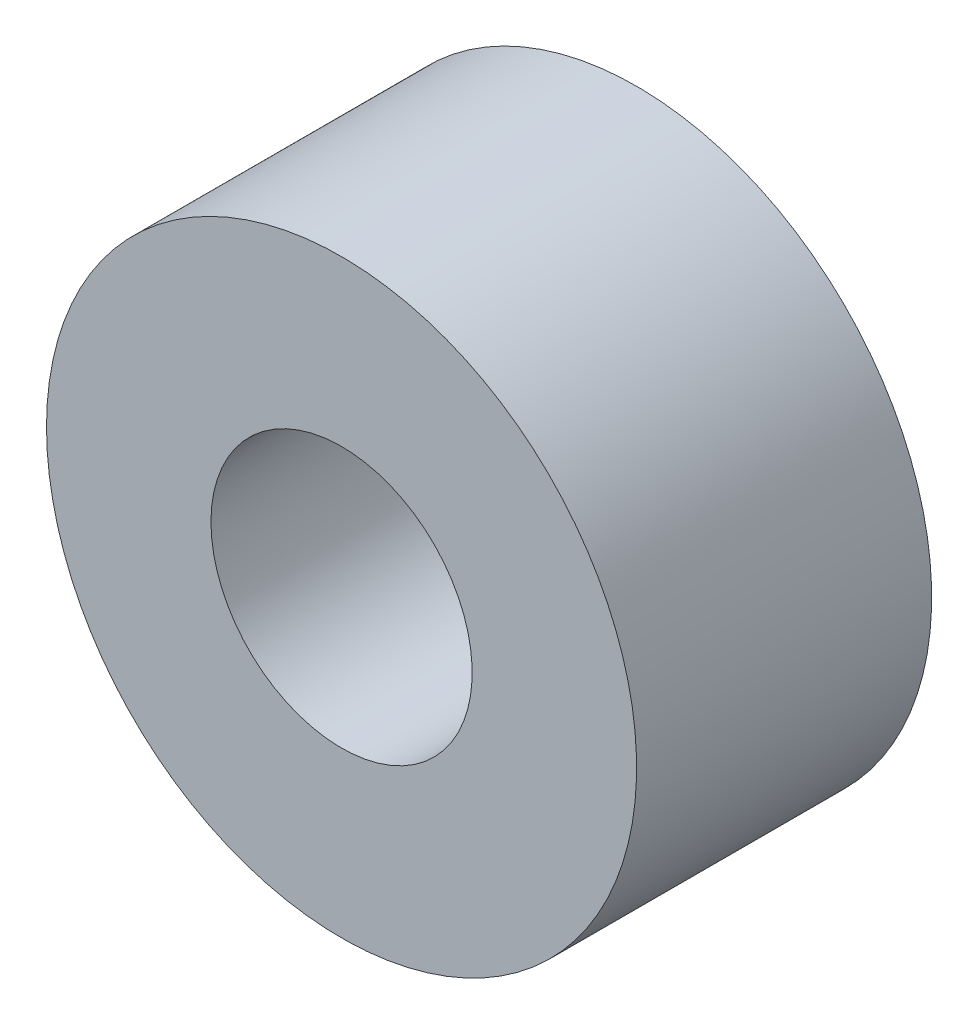
from build123d import *

# Parameters (mm, degrees)
SKETCH1_R      = 4.7625
SKETCH1_R_2    = 2.1082
EXTRUDE1_DEPTH = 2.38125


with BuildPart() as part:
    # Sketch1 → Extrude1 (new, symmetric)
    with BuildSketch(Plane.XY):
        with Locations(Location((0, 0, 0), (0, 0, 180))):
            Circle(SKETCH1_R)
        with Locations(Location((0, 0, 0), (0, 0, 180))):
            Circle(SKETCH1_R_2, mode=Mode.SUBTRACT)
    extrude(amount=EXTRUDE1_DEPTH, both=True)


solid = part.part
